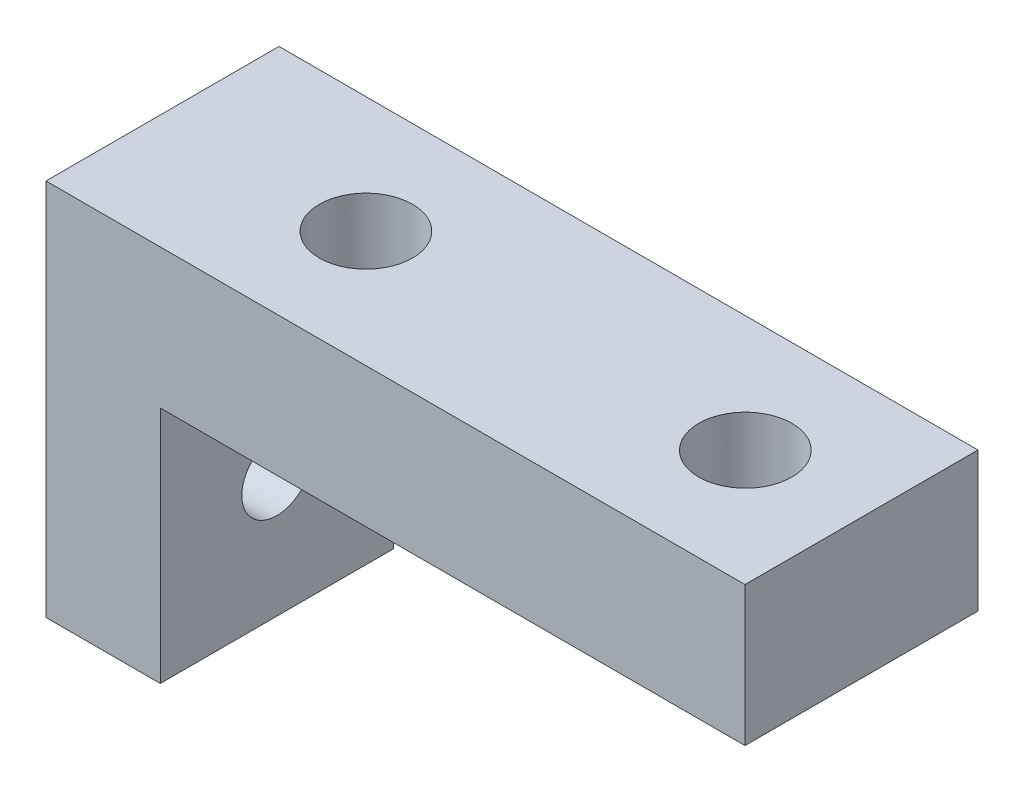
from build123d import *

# Parameters (mm, degrees)
BOSS_EXTRUDE1_DEPTH     = 10
CUT_EXTRUDE1_DEPTH      = 58.959168463
CUT_EXTRUDE1_DEPTH_BACK = 58.959168463
SKETCH7_R               = 0.991796169
CUT_EXTRUDE2_DEPTH      = 58.959168463
CUT_EXTRUDE2_DEPTH_BACK = 58.959168463
CUT_EXTRUDE3_DEPTH      = 36.542676149
CUT_EXTRUDE3_DEPTH_BACK = 36.542676149
SKETCH9_R               = 0.986488891
CUT_EXTRUDE4_DEPTH      = 36.542676149
CUT_EXTRUDE4_DEPTH_BACK = 36.542676149
SKETCH10_R              = 1.5
CUT_EXTRUDE5_DEPTH      = 58.959168463
CUT_EXTRUDE5_DEPTH_BACK = 58.959168463
SKETCH12_R              = 2


with BuildPart() as part:
    # Sketch1 → Boss-Extrude1 (new body)
    with BuildSketch(Plane.XY):
        Polygon((-54.735576923, 0), (-24.735576923, 0), (-24.735576923, -5.985576923), (-49.831730769, -5.985576923), (-49.831730769, -16.225961538), (-54.735576923, -16.225961538), align=None)
    extrude(amount=BOSS_EXTRUDE1_DEPTH)

    # Sketch7 → Cut-Extrude1 (cut, two sides: drawn at the far end of the back side and taken through both)
    with BuildSketch(Plane(origin=(0, 0, 0), x_dir=(1, 0, 0), z_dir=(0, 1, 0)).offset(-CUT_EXTRUDE1_DEPTH_BACK)):
        with Locations(Location((-29.721531387, -5, 0), (0, 0, 270))):
            Circle(SKETCH7_R)
    extrude(amount=CUT_EXTRUDE1_DEPTH + CUT_EXTRUDE1_DEPTH_BACK, mode=Mode.SUBTRACT)

    # Sketch2 → Cut-Extrude2 (cut, two sides: drawn at the far end of the back side and taken through both)
    with BuildSketch(Plane(origin=(0, 0, 0), x_dir=(1, 0, 0), z_dir=(0, 1, 0)).offset(-CUT_EXTRUDE2_DEPTH_BACK)):
        with BuildLine():
            ThreePointArc((-45.014660465, -5), (-46.003925048, -4.010735417), (-46.993189631, -5))
            Line((-46.993189631, -5), (-45.014660465, -5))
        make_face()
        with BuildLine():
            Line((-45.014660465, -5), (-46.993189631, -5))
            ThreePointArc((-46.993189631, -5), (-46.003925048, -5.989264583), (-45.014660465, -5))
        make_face()
    extrude(amount=CUT_EXTRUDE2_DEPTH + CUT_EXTRUDE2_DEPTH_BACK, mode=Mode.SUBTRACT)

    # Sketch9 → Cut-Extrude3 (cut, two sides: drawn at the far end of the back side and taken through both)
    with BuildSketch(Plane.ZY.offset(54.735576923).offset(-CUT_EXTRUDE3_DEPTH_BACK)):
        with Locations((5, -10.990115231)):
            Circle(SKETCH9_R)
    extrude(amount=CUT_EXTRUDE3_DEPTH + CUT_EXTRUDE3_DEPTH_BACK, mode=Mode.SUBTRACT)

    # Sketch10 → Cut-Extrude4 (cut, two sides: drawn at the far end of the back side and taken through both)
    with BuildSketch(Plane.ZY.offset(54.735576923).offset(-CUT_EXTRUDE4_DEPTH_BACK)):
        with Locations((5, -10.990115231)):
            Circle(SKETCH10_R)
    extrude(amount=CUT_EXTRUDE4_DEPTH + CUT_EXTRUDE4_DEPTH_BACK, mode=Mode.SUBTRACT)

    # Sketch12 → Cut-Extrude5 (cut, two sides: drawn at the far end of the back side and taken through both)
    with BuildSketch(Plane(origin=(0, 0, 0), x_dir=(1, 0, 0), z_dir=(0, 1, 0)).offset(-CUT_EXTRUDE5_DEPTH_BACK)):
        with Locations(Location((-46.003925048, -5, 0), (0, 0, 270))):
            Circle(SKETCH12_R)
        with Locations(Location((-29.721531387, -5, 0), (0, 0, 270))):
            Circle(SKETCH12_R)
    extrude(amount=CUT_EXTRUDE5_DEPTH + CUT_EXTRUDE5_DEPTH_BACK, mode=Mode.SUBTRACT)


solid = part.part
